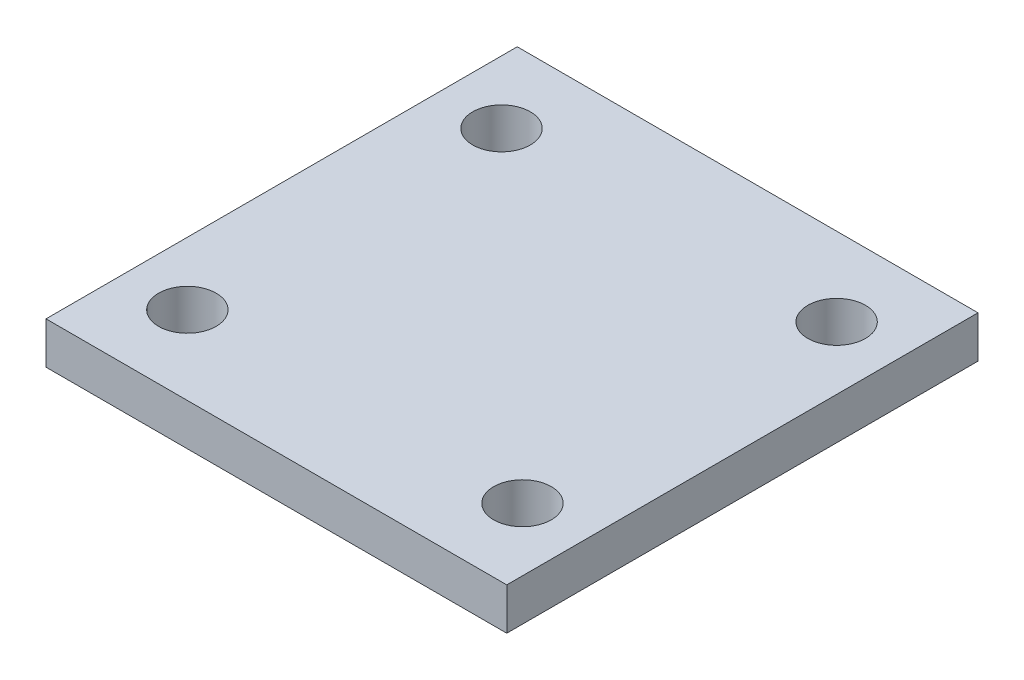
from build123d import *

# Parameters (mm, degrees)
SKETCH1_W            = 44
SKETCH1_H            = 45
BOSS_EXTRUDE1_DEPTH  = 4
M5_CLEARANCE_HOLE1_D = 5.5


with BuildPart() as part:
    # Sketch1 → Boss-Extrude1 (new body)
    with BuildSketch(Plane(origin=(0, 0, 0), x_dir=(1, 0, 0), z_dir=(0, 1, 0))):
        Rectangle(SKETCH1_W, SKETCH1_H)
    extrude(amount=BOSS_EXTRUDE1_DEPTH)

    # M5 Clearance Hole1 (through all)
    with Locations(Plane(origin=(0, 4, 0), x_dir=(1, 0, 0), z_dir=(0, 1, 0))):
        with Locations((-16, -15), (-16, 15), (16, 15), (16, -15)):
            Hole(M5_CLEARANCE_HOLE1_D / 2)


solid = part.part
